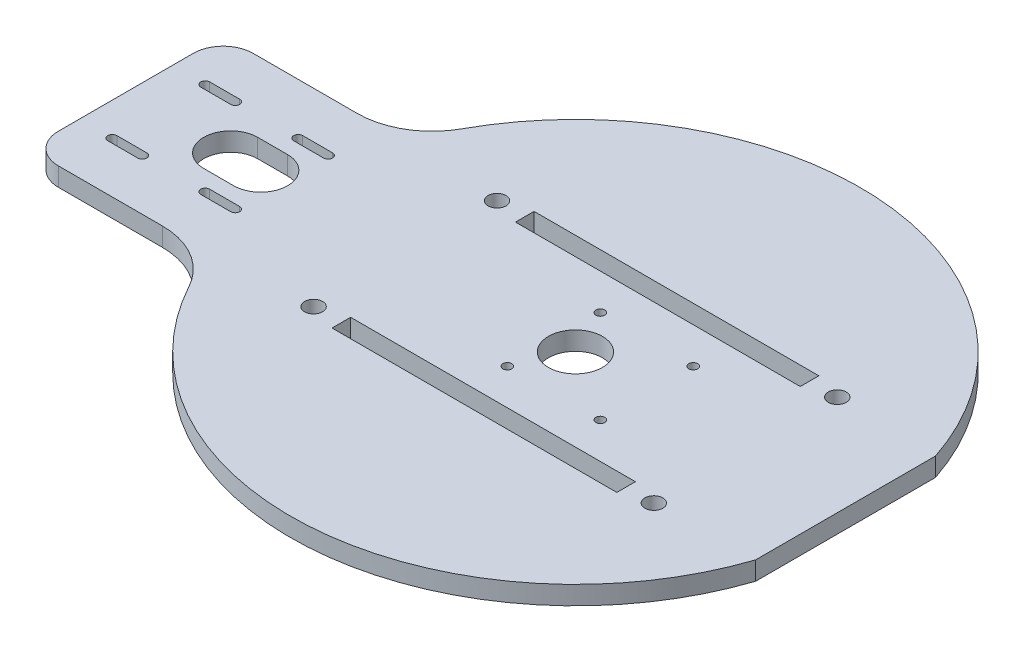
from build123d import *

# Parameters (mm, degrees)
SKETCH1_R           = 9
BOSS_EXTRUDE1_DEPTH = 6.2
CUT_EXTRUDE1_REACH  = 179.661
SKETCH2_R           = 1.5
CUT_EXTRUDE2_REACH  = 179.661
SKETCH3_R           = 3
LPATTERN1_COUNT     = 2
LPATTERN1_PITCH     = 61.2
CUT_EXTRUDE3_REACH  = 179.661
SKETCH5_W           = 95
SKETCH5_H           = 6.2


with BuildPart() as part:
    # Sketch1 → Boss-Extrude1 (new body)
    with BuildSketch(Plane(origin=(0, 0, 0), x_dir=(1, 0, 0), z_dir=(0, 1, 0))):
        with BuildLine():
            ThreePointArc((-140, 32.5), (-147.071067812, 29.571067812), (-150, 22.5))
            Line((-150, 22.5), (-150, -22.5))
            ThreePointArc((-150, -22.5), (-147.071067812, -29.571067812), (-140, -32.5))
            Line((-140, -32.5), (-105.326872165, -32.5))
            ThreePointArc((-105.326872165, -32.5), (-92.569113088, -36.000242249), (-83.383773797, -45.520833333))
            ThreePointArc((-83.383773797, -45.520833333), (8.463545381, -94.622240512), (90.138781887, -30))
            Line((90.138781887, -30), (90.138781887, 30))
            ThreePointArc((90.138781887, 30), (8.463545381, 94.622240512), (-83.383773797, 45.520833333))
            ThreePointArc((-83.383773797, 45.520833333), (-92.569113088, 36.000242249), (-105.326872165, 32.5))
            Line((-105.326872165, 32.5), (-140, 32.5))
        make_face()
        with BuildLine():
            ThreePointArc((-139, -17), (-140.5, -15.5), (-139, -14))
            Line((-139, -14), (-129, -14))
            ThreePointArc((-129, -14), (-127.5, -15.5), (-129, -17))
            Line((-129, -17), (-139, -17))
        make_face(mode=Mode.SUBTRACT)
        with BuildLine():
            ThreePointArc((-108, -17), (-109.5, -15.5), (-108, -14))
            Line((-108, -14), (-98, -14))
            ThreePointArc((-98, -14), (-96.5, -15.5), (-98, -17))
            Line((-98, -17), (-108, -17))
        make_face(mode=Mode.SUBTRACT)
        with BuildLine():
            ThreePointArc((-115, -9), (-124, 0), (-115, 9))
            Line((-115, 9), (-105, 9))
            ThreePointArc((-105, 9), (-96, 0), (-105, -9))
            Line((-105, -9), (-115, -9))
        make_face(mode=Mode.SUBTRACT)
        Circle(SKETCH1_R, mode=Mode.SUBTRACT)
        with BuildLine():
            ThreePointArc((-139, 14), (-140.5, 15.5), (-139, 17))
            Line((-139, 17), (-129, 17))
            ThreePointArc((-129, 17), (-127.5, 15.5), (-129, 14))
            Line((-129, 14), (-139, 14))
        make_face(mode=Mode.SUBTRACT)
        with BuildLine():
            ThreePointArc((-108, 14), (-109.5, 15.5), (-108, 17))
            Line((-108, 17), (-98, 17))
            ThreePointArc((-98, 17), (-96.5, 15.5), (-98, 14))
            Line((-98, 14), (-108, 14))
        make_face(mode=Mode.SUBTRACT)
    extrude(amount=-BOSS_EXTRUDE1_DEPTH)

    # Sketch2 → Cut-Extrude1 (cut, up to next)
    with BuildSketch(Plane.XZ.offset(6.2), mode=Mode.PRIVATE) as cut_extrude1_sk1:
        with Locations(Location((-7.2, 15.5, 0), (0, 0, 270))):
            Circle(SKETCH2_R)
    cut_extrude1_tool1 = extrude(cut_extrude1_sk1.sketch, amount=-CUT_EXTRUDE1_REACH, mode=Mode.PRIVATE) & part.part
    # Sketch2 → Cut-Extrude1 (cut, up to next)
    with BuildSketch(Plane.XZ.offset(6.2), mode=Mode.PRIVATE) as cut_extrude1_sk2:
        with Locations(Location((-7.2, -15.5, 0), (0, 0, 270))):
            Circle(SKETCH2_R)
    cut_extrude1_tool2 = extrude(cut_extrude1_sk2.sketch, amount=-CUT_EXTRUDE1_REACH, mode=Mode.PRIVATE) & part.part
    # Sketch2 → Cut-Extrude1 (cut, up to next)
    with BuildSketch(Plane.XZ.offset(6.2), mode=Mode.PRIVATE) as cut_extrude1_sk3:
        with Locations(Location((23.8, 15.5, 0), (0, 0, 270))):
            Circle(SKETCH2_R)
    cut_extrude1_tool3 = extrude(cut_extrude1_sk3.sketch, amount=-CUT_EXTRUDE1_REACH, mode=Mode.PRIVATE) & part.part
    # Sketch2 → Cut-Extrude1 (cut, up to next)
    with BuildSketch(Plane.XZ.offset(6.2), mode=Mode.PRIVATE) as cut_extrude1_sk4:
        with Locations(Location((23.8, -15.5, 0), (0, 0, 270))):
            Circle(SKETCH2_R)
    cut_extrude1_tool4 = extrude(cut_extrude1_sk4.sketch, amount=-CUT_EXTRUDE1_REACH, mode=Mode.PRIVATE) & part.part
    add(cut_extrude1_tool1.solids().sort_by_distance((-7.2, -6.2, 15.5))[0], mode=Mode.SUBTRACT)
    add(cut_extrude1_tool2.solids().sort_by_distance((-7.2, -6.2, -15.5))[0], mode=Mode.SUBTRACT)
    add(cut_extrude1_tool3.solids().sort_by_distance((23.8, -6.2, 15.5))[0], mode=Mode.SUBTRACT)
    add(cut_extrude1_tool4.solids().sort_by_distance((23.8, -6.2, -15.5))[0], mode=Mode.SUBTRACT)

    # Sketch3 → Cut-Extrude2 (cut, up to next)
    with BuildSketch(Plane.XZ.offset(6.2), mode=Mode.PRIVATE) as cut_extrude2_sk1:
        with Locations(Location((-56.75, -30.6, 0), (0, 0, 270))):
            Circle(SKETCH3_R)
    cut_extrude2_tool1 = extrude(cut_extrude2_sk1.sketch, amount=-CUT_EXTRUDE2_REACH, mode=Mode.PRIVATE) & part.part
    # Sketch3 → Cut-Extrude2 (cut, up to next)
    with BuildSketch(Plane.XZ.offset(6.2), mode=Mode.PRIVATE) as cut_extrude2_sk2:
        with Locations(Location((56.75, -30.6, 0), (0, 0, 270))):
            Circle(SKETCH3_R)
    cut_extrude2_tool2 = extrude(cut_extrude2_sk2.sketch, amount=-CUT_EXTRUDE2_REACH, mode=Mode.PRIVATE) & part.part
    cut_extrude2_1 = cut_extrude2_tool1.solids().sort_by_distance((-56.75, -6.2, -30.6))[0]
    add(cut_extrude2_1, mode=Mode.SUBTRACT)
    cut_extrude2_2 = cut_extrude2_tool2.solids().sort_by_distance((56.75, -6.2, -30.6))[0]
    add(cut_extrude2_2, mode=Mode.SUBTRACT)
    cut_extrude2 = cut_extrude2_1 + cut_extrude2_2  # Cut-Extrude2 as one shape, for the pattern or mirror that repeats it

    # LPattern1: Cut-Extrude2 ×2
    with Locations(*[(0, 0, i * LPATTERN1_PITCH) for i in range(1, LPATTERN1_COUNT)]):
        add(cut_extrude2, mode=Mode.SUBTRACT)

    # Sketch5 → Cut-Extrude3 (cut, up to next)
    with BuildSketch(Plane.XZ.offset(6.2), mode=Mode.PRIVATE) as cut_extrude3_sk1:
        with Locations((0, 30.6)):
            Rectangle(SKETCH5_W, SKETCH5_H)
    cut_extrude3_tool1 = extrude(cut_extrude3_sk1.sketch, amount=-CUT_EXTRUDE3_REACH, mode=Mode.PRIVATE) & part.part
    # Sketch5 → Cut-Extrude3 (cut, up to next)
    with BuildSketch(Plane.XZ.offset(6.2), mode=Mode.PRIVATE) as cut_extrude3_sk2:
        with Locations((0, -30.6)):
            Rectangle(SKETCH5_W, SKETCH5_H)
    cut_extrude3_tool2 = extrude(cut_extrude3_sk2.sketch, amount=-CUT_EXTRUDE3_REACH, mode=Mode.PRIVATE) & part.part
    add(cut_extrude3_tool1.solids().sort_by_distance((0, -6.2, 30.6))[0], mode=Mode.SUBTRACT)
    add(cut_extrude3_tool2.solids().sort_by_distance((0, -6.2, -30.6))[0], mode=Mode.SUBTRACT)


solid = part.part
